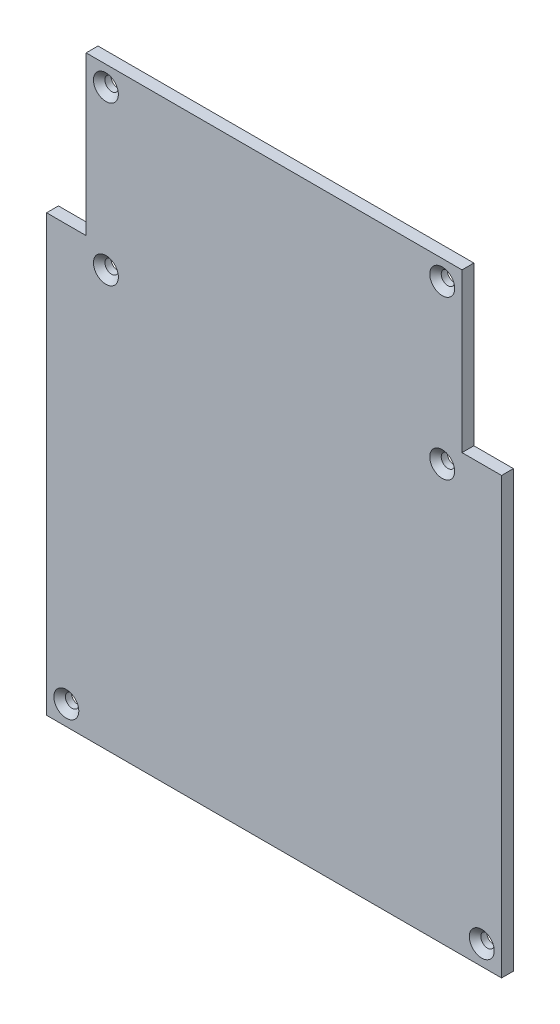
from build123d import *

# Parameters (mm, degrees)
EXTRUDE_1_DEPTH              = 3
HOLE_WIZARD_M3_1_D           = 3.4
HOLE_WIZARD_M3_1_DEPTH       = 15
HOLE_WIZARD_M3_1_CSINK_D     = 6.3
HOLE_WIZARD_M3_1_CSINK_ANGLE = 90
HOLE_WIZARD_M3_1_TIP         = 1.021463052


with BuildPart() as part:
    # 草圖1 → 填料-伸長1 (new body)
    with BuildSketch(Plane.XY):
        Polygon((-57.5, -55), (57.5, -55), (57.5, 55), (47.5, 55), (47.5, 95), (-47.5, 95), (-47.5, 55), (-57.5, 55), align=None)
    extrude(amount=EXTRUDE_1_DEPTH)

    # M3 錐坑平頭螺釘的錐孔1
    with Locations(Plane.XY.offset(3)):
        with Locations((-52.5, -50), (-42.5, 90), (-42.5, 50), (42.5, 90), (42.5, 50), (52.5, -50)):
            CounterSinkHole(HOLE_WIZARD_M3_1_D / 2, HOLE_WIZARD_M3_1_CSINK_D / 2, depth=HOLE_WIZARD_M3_1_DEPTH, counter_sink_angle=HOLE_WIZARD_M3_1_CSINK_ANGLE)
            with Locations((0, 0, -(HOLE_WIZARD_M3_1_DEPTH + HOLE_WIZARD_M3_1_TIP / 2))):  # 118° drill point
                Cone(0, HOLE_WIZARD_M3_1_D / 2, HOLE_WIZARD_M3_1_TIP, mode=Mode.SUBTRACT)


solid = part.part
